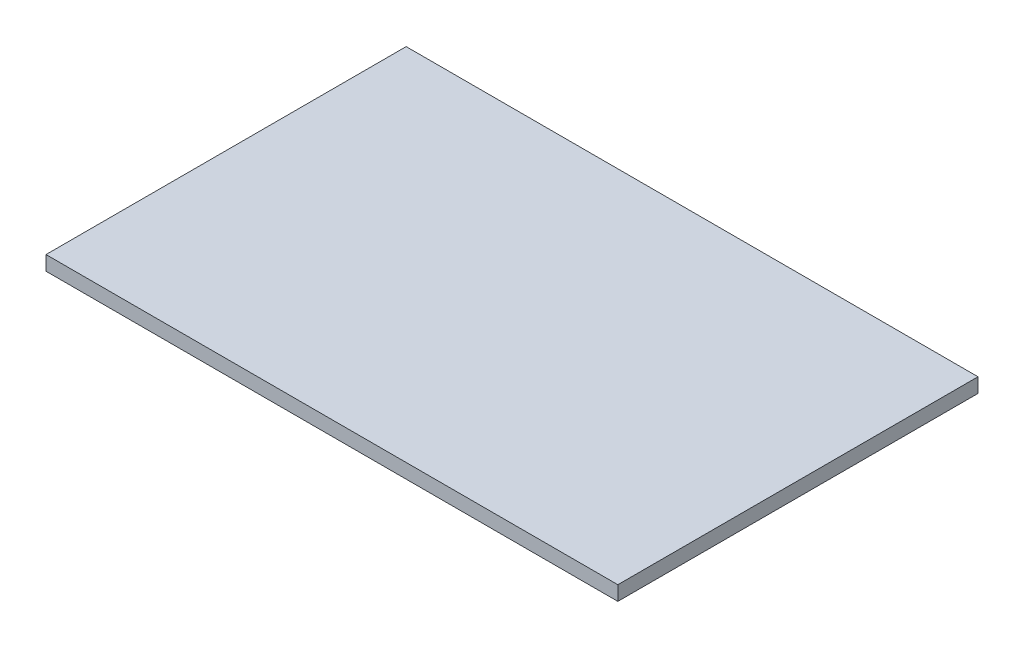
from build123d import *

# Parameters (mm, degrees)
SKETCH1_W           = 1502
SKETCH1_H           = 946
BOSS_EXTRUDE1_DEPTH = 38
SKETCH1_4_W         = 1402
SKETCH1_4_H         = 846
CUT_EXTRUDE1_DEPTH  = 30


with BuildPart() as part:
    # Sketch1 → Boss-Extrude1 (new body)
    with BuildSketch(Plane(origin=(0, 0, 0), x_dir=(1, 0, 0), z_dir=(0, 1, 0))):
        with Locations((167.925465839, -6.540372671)):
            Rectangle(SKETCH1_W, SKETCH1_H)
    extrude(amount=BOSS_EXTRUDE1_DEPTH)

    # Sketch1<4> → Cut-Extrude1 (cut)
    with BuildSketch(Plane(origin=(0, 0, 0), x_dir=(1, 0, 0), z_dir=(0, 1, 0))):
        with Locations((167.925465839, -6.540372671)):
            Rectangle(SKETCH1_4_W, SKETCH1_4_H)
    extrude(amount=CUT_EXTRUDE1_DEPTH, mode=Mode.SUBTRACT)


solid = part.part
